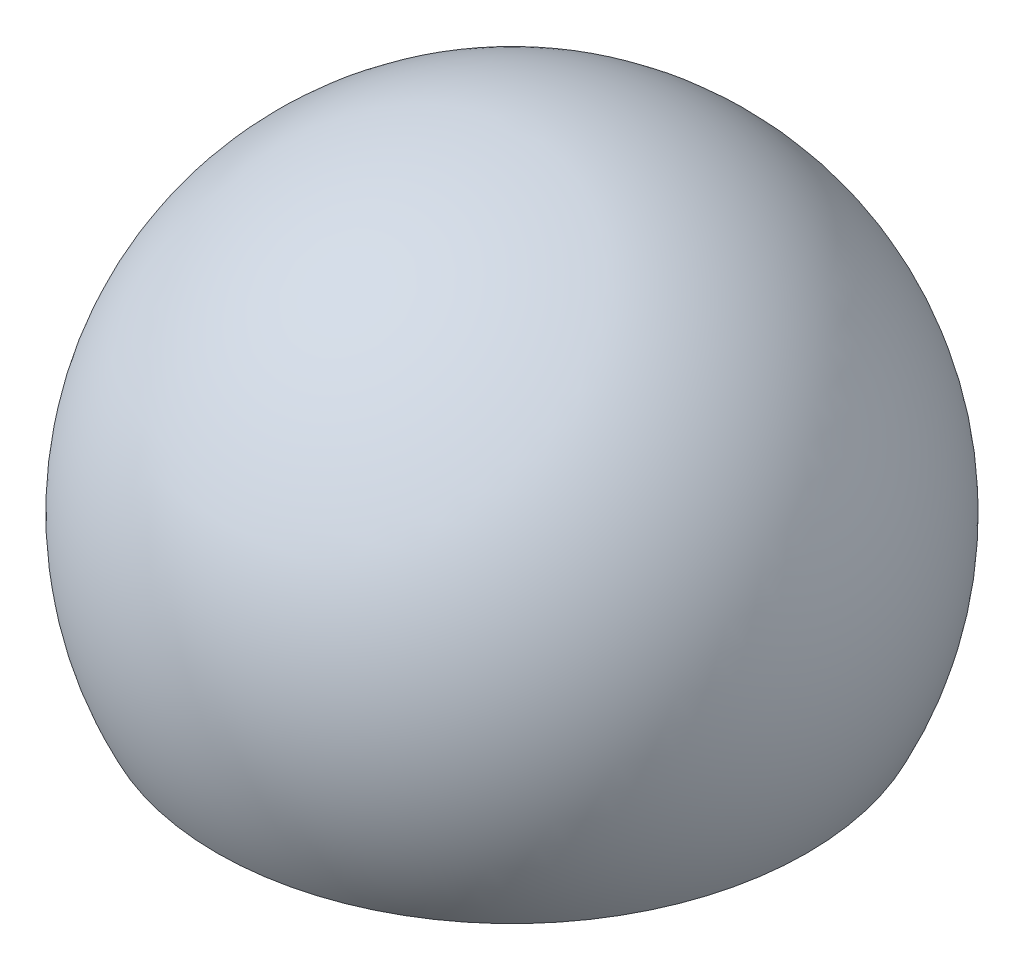
from build123d import *

# Parameters (mm, degrees)
SKETCH2_W          = 8
SKETCH2_H          = 8
CUT_EXTRUDE1_DEPTH = 8


with BuildPart() as part:
    # Sketch1 → Revolve1 (revolve)
    with BuildSketch(Plane.XY, mode=Mode.PRIVATE) as revolve1_sk:
        with BuildLine():
            Line((-8, 0), (0, 0))
            Line((0, 0), (0, 12.94427191))
            ThreePointArc((0, 12.94427191), (-7.60845213, 8.702282018), (-8, 0))
        make_face()
    revolve(revolve1_sk.sketch.rotate(Axis((0, 0, 0), (0, 1, 0)), 180), axis=Axis((0, 0, 0), (0, 1, 0)))

    # Sketch2 → Cut-Extrude1 (cut)
    with BuildSketch(Plane.XZ):
        Rectangle(SKETCH2_W, SKETCH2_H)
    extrude(amount=-CUT_EXTRUDE1_DEPTH, mode=Mode.SUBTRACT)


solid = part.part
